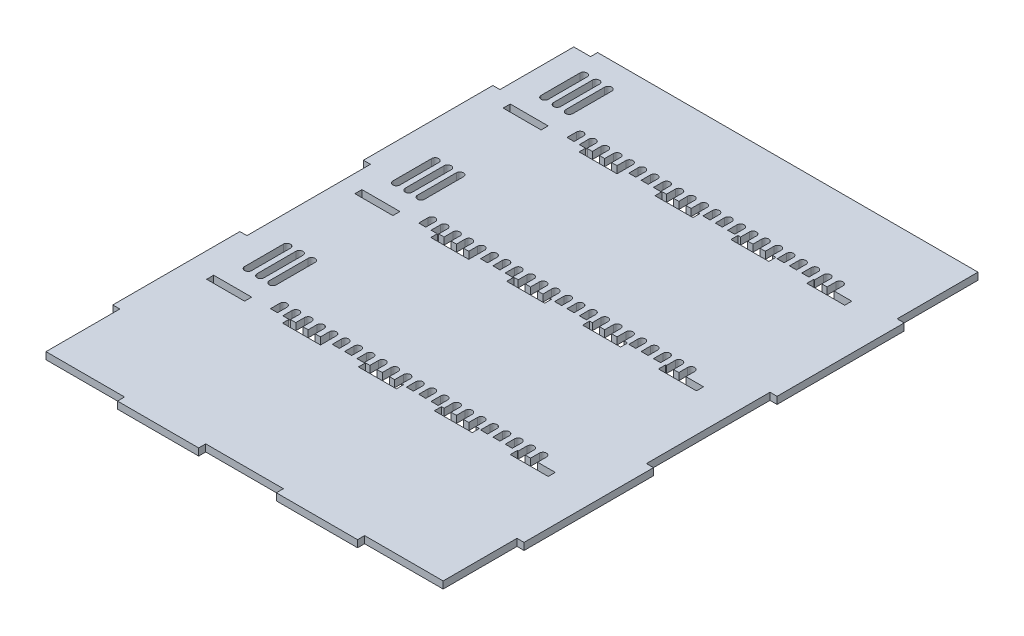
from build123d import *

# Parameters (mm, degrees)
SKETCH1_W           = 233
SKETCH1_H           = 307
BOSS_EXTRUDE1_DEPTH = 4
SKETCH2_W           = 44
SKETCH2_H           = 4
SKETCH2_W_2         = 4
SKETCH2_H_2         = 45.833333333
CUT_EXTRUDE1_DEPTH  = 4
SKETCH3_W           = 21.5
SKETCH3_H           = 4
CUT_EXTRUDE2_DEPTH  = 4
SKETCH4_W           = 4
SKETCH4_H           = 70
CUT_EXTRUDE3_DEPTH  = 4
SKETCH5_W           = 4
SKETCH5_H           = 70
CUT_EXTRUDE4_DEPTH  = 4
CUT_EXTRUDE5_DEPTH  = 4
LPATTERN1_COUNT     = 3
LPATTERN1_PITCH     = 84


with BuildPart() as part:
    # Sketch1 → Boss-Extrude1 (new body)
    with BuildSketch(Plane(origin=(0, 0, 0), x_dir=(1, 0, 0), z_dir=(0, 1, 0))):
        with Locations((116.5, 153.5)):
            Rectangle(SKETCH1_W, SKETCH1_H)
    extrude(amount=BOSS_EXTRUDE1_DEPTH)

    # Sketch2 → Cut-Extrude1 (cut)
    with BuildSketch(Plane(origin=(0, 4, 0), x_dir=(1, 0, 0), z_dir=(0, 1, 0))):
        Polygon((0, 307), (0, 261.166666667), (4, 261.166666667), (4, 303), (13.5, 303), (13.5, 307), align=None)
        Polygon((0, 45.833333333), (0, 0), (48.5, 0), (48.5, 4), (4, 4), (4, 45.833333333), align=None)
        with Locations((116.5, 2)):
            Rectangle(SKETCH2_W, SKETCH2_H)
        Polygon((184.5, 4), (184.5, 0), (233, 0), (233, 45.833333333), (229, 45.833333333), (229, 4), align=None)
        with Locations((231, 284.083333334)):
            Rectangle(SKETCH2_W_2, SKETCH2_H_2)
    extrude(amount=-CUT_EXTRUDE1_DEPTH, mode=Mode.SUBTRACT)

    # Sketch3 → Cut-Extrude2 (cut)
    with BuildSketch(Plane.XZ):
        with Locations((196.75, -255)):
            Rectangle(SKETCH3_W, SKETCH3_H)
        with Locations((153.75, -255)):
            Rectangle(SKETCH3_W, SKETCH3_H)
        with Locations((110.75, -255)):
            Rectangle(SKETCH3_W, SKETCH3_H)
        with Locations((67.75, -255)):
            Rectangle(SKETCH3_W, SKETCH3_H)
        with Locations((24.75, -255)):
            Rectangle(SKETCH3_W, SKETCH3_H)
        with Locations((24.75, -171)):
            Rectangle(SKETCH3_W, SKETCH3_H)
        with Locations((67.75, -171)):
            Rectangle(SKETCH3_W, SKETCH3_H)
        with Locations((110.75, -171)):
            Rectangle(SKETCH3_W, SKETCH3_H)
        with Locations((153.75, -171)):
            Rectangle(SKETCH3_W, SKETCH3_H)
        with Locations((196.75, -171)):
            Rectangle(SKETCH3_W, SKETCH3_H)
        with Locations((24.75, -87)):
            Rectangle(SKETCH3_W, SKETCH3_H)
        with Locations((67.75, -87)):
            Rectangle(SKETCH3_W, SKETCH3_H)
        with Locations((110.75, -87)):
            Rectangle(SKETCH3_W, SKETCH3_H)
        with Locations((153.75, -87)):
            Rectangle(SKETCH3_W, SKETCH3_H)
        with Locations((196.75, -87)):
            Rectangle(SKETCH3_W, SKETCH3_H)
    extrude(amount=-CUT_EXTRUDE2_DEPTH, mode=Mode.SUBTRACT)

    # Sketch4 → Cut-Extrude3 (cut)
    with BuildSketch(Plane(origin=(0, 4, 0), x_dir=(1, 0, 0), z_dir=(0, 1, 0))):
        with Locations((2, 152.833333333)):
            Rectangle(SKETCH4_W, SKETCH4_H)
    extrude(amount=-CUT_EXTRUDE3_DEPTH, mode=Mode.SUBTRACT)

    # Sketch5 → Cut-Extrude4 (cut)
    with BuildSketch(Plane(origin=(0, 4, 0), x_dir=(1, 0, 0), z_dir=(0, 1, 0))):
        with Locations((231, 154.166666667)):
            Rectangle(SKETCH5_W, SKETCH5_H)
    extrude(amount=-CUT_EXTRUDE4_DEPTH, mode=Mode.SUBTRACT)

    # Sketch6 → Cut-Extrude5 (cut)
    with BuildSketch(Plane(origin=(0, 4, 0), x_dir=(1, 0, 0), z_dir=(0, 1, 0))):
        with BuildLine():
            Line((22.5, 292), (22.5, 270))
            ThreePointArc((22.5, 270), (20.5, 268), (18.5, 270))
            Line((18.5, 270), (18.5, 292))
            ThreePointArc((18.5, 292), (20.5, 294), (22.5, 292))
        make_face()
        with BuildLine():
            Line((109.501076108, 256.657930855), (113.501076108, 256.657930855))
            Line((113.501076108, 256.657930855), (113.501076108, 261.998460837))
            ThreePointArc((113.501076108, 261.998460837), (111.501076108, 263.998460837), (109.501076108, 261.998460837))
            Line((109.501076108, 261.998460837), (109.501076108, 256.657930855))
        make_face()
        with BuildLine():
            Line((25.540156573, 292), (25.540156573, 270))
            ThreePointArc((25.540156573, 270), (27.540156573, 268), (29.540156573, 270))
            Line((29.540156573, 270), (29.540156573, 292))
            ThreePointArc((29.540156573, 292), (27.540156573, 294), (25.540156573, 292))
        make_face()
        with BuildLine():
            Line((36.460919536, 292), (36.460919536, 270))
            ThreePointArc((36.460919536, 270), (34.460919536, 268), (32.460919536, 270))
            Line((32.460919536, 270), (32.460919536, 292))
            ThreePointArc((32.460919536, 292), (34.460919536, 294), (36.460919536, 292))
        make_face()
        with BuildLine():
            Line((102.501076108, 261.998460837), (102.501076108, 256.657930855))
            Line((102.501076108, 256.657930855), (106.501076108, 256.657930855))
            Line((106.501076108, 256.657930855), (106.501076108, 261.998460837))
            ThreePointArc((106.501076108, 261.998460837), (104.501076108, 263.998460837), (102.501076108, 261.998460837))
        make_face()
        with BuildLine():
            Line((95.501076108, 261.998460837), (95.501076108, 256.657930855))
            Line((95.501076108, 256.657930855), (99.501076108, 256.657930855))
            Line((99.501076108, 256.657930855), (99.501076108, 261.998460837))
            ThreePointArc((99.501076108, 261.998460837), (97.501076108, 263.998460837), (95.501076108, 261.998460837))
        make_face()
        with BuildLine():
            Line((88.501076108, 261.998460837), (88.501076108, 256.657930855))
            Line((88.501076108, 256.657930855), (92.501076108, 256.657930855))
            Line((92.501076108, 256.657930855), (92.501076108, 261.998460837))
            ThreePointArc((92.501076108, 261.998460837), (90.501076108, 263.998460837), (88.501076108, 261.998460837))
        make_face()
        with BuildLine():
            Line((81.501076108, 261.998460837), (81.501076108, 256.657930855))
            Line((81.501076108, 256.657930855), (85.501076108, 256.657930855))
            Line((85.501076108, 256.657930855), (85.501076108, 261.998460837))
            ThreePointArc((85.501076108, 261.998460837), (83.501076108, 263.998460837), (81.501076108, 261.998460837))
        make_face()
        with BuildLine():
            Line((74.501076108, 261.998460837), (74.501076108, 256.657930855))
            Line((74.501076108, 256.657930855), (78.501076108, 256.657930855))
            Line((78.501076108, 256.657930855), (78.501076108, 261.998460837))
            ThreePointArc((78.501076108, 261.998460837), (76.501076108, 263.998460837), (74.501076108, 261.998460837))
        make_face()
        with BuildLine():
            Line((67.501076108, 261.998460837), (67.501076108, 256.657930855))
            Line((67.501076108, 256.657930855), (71.501076108, 256.657930855))
            Line((71.501076108, 256.657930855), (71.501076108, 261.998460837))
            ThreePointArc((71.501076108, 261.998460837), (69.501076108, 263.998460837), (67.501076108, 261.998460837))
        make_face()
        with BuildLine():
            Line((60.501076108, 261.998460837), (60.501076108, 256.657930855))
            Line((60.501076108, 256.657930855), (64.501076108, 256.657930855))
            Line((64.501076108, 256.657930855), (64.501076108, 261.998460837))
            ThreePointArc((64.501076108, 261.998460837), (62.501076108, 263.998460837), (60.501076108, 261.998460837))
        make_face()
        with BuildLine():
            Line((53.501076108, 261.998460837), (53.501076108, 256.657930855))
            Line((53.501076108, 256.657930855), (57.501076108, 256.657930855))
            Line((57.501076108, 256.657930855), (57.501076108, 261.998460837))
            ThreePointArc((57.501076108, 261.998460837), (55.501076108, 263.998460837), (53.501076108, 261.998460837))
        make_face()
        with BuildLine():
            Line((116.501076108, 261.998460837), (116.501076108, 256.657930855))
            Line((116.501076108, 256.657930855), (120.501076108, 256.657930855))
            Line((120.501076108, 256.657930855), (120.501076108, 261.998460837))
            ThreePointArc((120.501076108, 261.998460837), (118.501076108, 263.998460837), (116.501076108, 261.998460837))
        make_face()
        with BuildLine():
            Line((123.501076108, 261.998460837), (123.501076108, 256.657930855))
            Line((123.501076108, 256.657930855), (127.501076108, 256.657930855))
            Line((127.501076108, 256.657930855), (127.501076108, 261.998460837))
            ThreePointArc((127.501076108, 261.998460837), (125.501076108, 263.998460837), (123.501076108, 261.998460837))
        make_face()
        with BuildLine():
            Line((130.501076108, 261.998460837), (130.501076108, 256.657930855))
            Line((130.501076108, 256.657930855), (134.501076108, 256.657930855))
            Line((134.501076108, 256.657930855), (134.501076108, 261.998460837))
            ThreePointArc((134.501076108, 261.998460837), (132.501076108, 263.998460837), (130.501076108, 261.998460837))
        make_face()
        with BuildLine():
            Line((137.501076108, 261.998460837), (137.501076108, 256.657930855))
            Line((137.501076108, 256.657930855), (141.501076108, 256.657930855))
            Line((141.501076108, 256.657930855), (141.501076108, 261.998460837))
            ThreePointArc((141.501076108, 261.998460837), (139.501076108, 263.998460837), (137.501076108, 261.998460837))
        make_face()
        with BuildLine():
            Line((144.501076108, 261.998460837), (144.501076108, 256.657930855))
            Line((144.501076108, 256.657930855), (148.501076108, 256.657930855))
            Line((148.501076108, 256.657930855), (148.501076108, 261.998460837))
            ThreePointArc((148.501076108, 261.998460837), (146.501076108, 263.998460837), (144.501076108, 261.998460837))
        make_face()
        with BuildLine():
            Line((151.501076108, 261.998460837), (151.501076108, 256.657930855))
            Line((151.501076108, 256.657930855), (155.501076108, 256.657930855))
            Line((155.501076108, 256.657930855), (155.501076108, 261.998460837))
            ThreePointArc((155.501076108, 261.998460837), (153.501076108, 263.998460837), (151.501076108, 261.998460837))
        make_face()
        with BuildLine():
            Line((158.501076108, 261.998460837), (158.501076108, 256.657930855))
            Line((158.501076108, 256.657930855), (162.501076108, 256.657930855))
            Line((162.501076108, 256.657930855), (162.501076108, 261.998460837))
            ThreePointArc((162.501076108, 261.998460837), (160.501076108, 263.998460837), (158.501076108, 261.998460837))
        make_face()
        with BuildLine():
            Line((165.501076108, 261.998460837), (165.501076108, 256.657930855))
            Line((165.501076108, 256.657930855), (169.501076108, 256.657930855))
            Line((169.501076108, 256.657930855), (169.501076108, 261.998460837))
            ThreePointArc((169.501076108, 261.998460837), (167.501076108, 263.998460837), (165.501076108, 261.998460837))
        make_face()
        with BuildLine():
            Line((172.501076108, 261.998460837), (172.501076108, 256.657930855))
            Line((172.501076108, 256.657930855), (176.501076108, 256.657930855))
            Line((176.501076108, 256.657930855), (176.501076108, 261.998460837))
            ThreePointArc((176.501076108, 261.998460837), (174.501076108, 263.998460837), (172.501076108, 261.998460837))
        make_face()
        with BuildLine():
            Line((179.501076108, 261.998460837), (179.501076108, 256.657930855))
            Line((179.501076108, 256.657930855), (183.501076108, 256.657930855))
            Line((183.501076108, 256.657930855), (183.501076108, 261.998460837))
            ThreePointArc((183.501076108, 261.998460837), (181.501076108, 263.998460837), (179.501076108, 261.998460837))
        make_face()
        with BuildLine():
            Line((186.501076108, 261.998460837), (186.501076108, 256.657930855))
            Line((186.501076108, 256.657930855), (190.501076108, 256.657930855))
            Line((190.501076108, 256.657930855), (190.501076108, 261.998460837))
            ThreePointArc((190.501076108, 261.998460837), (188.501076108, 263.998460837), (186.501076108, 261.998460837))
        make_face()
        with BuildLine():
            Line((46.501076108, 261.998460837), (46.501076108, 256.657930855))
            Line((46.501076108, 256.657930855), (50.501076108, 256.657930855))
            Line((50.501076108, 256.657930855), (50.501076108, 261.998460837))
            ThreePointArc((50.501076108, 261.998460837), (48.501076108, 263.998460837), (46.501076108, 261.998460837))
        make_face()
        with BuildLine():
            Line((193.501076108, 261.998460837), (193.501076108, 256.657930855))
            Line((193.501076108, 256.657930855), (197.501076108, 256.657930855))
            Line((197.501076108, 256.657930855), (197.501076108, 261.998460837))
            ThreePointArc((197.501076108, 261.998460837), (195.501076108, 263.998460837), (193.501076108, 261.998460837))
        make_face()
    cut_extrude5 = extrude(amount=-CUT_EXTRUDE5_DEPTH, mode=Mode.SUBTRACT)

    # LPattern1: Cut-Extrude5 ×3
    with Locations(*[(0, 0, i * LPATTERN1_PITCH) for i in range(1, LPATTERN1_COUNT)]):
        add(cut_extrude5, mode=Mode.SUBTRACT)


solid = part.part
